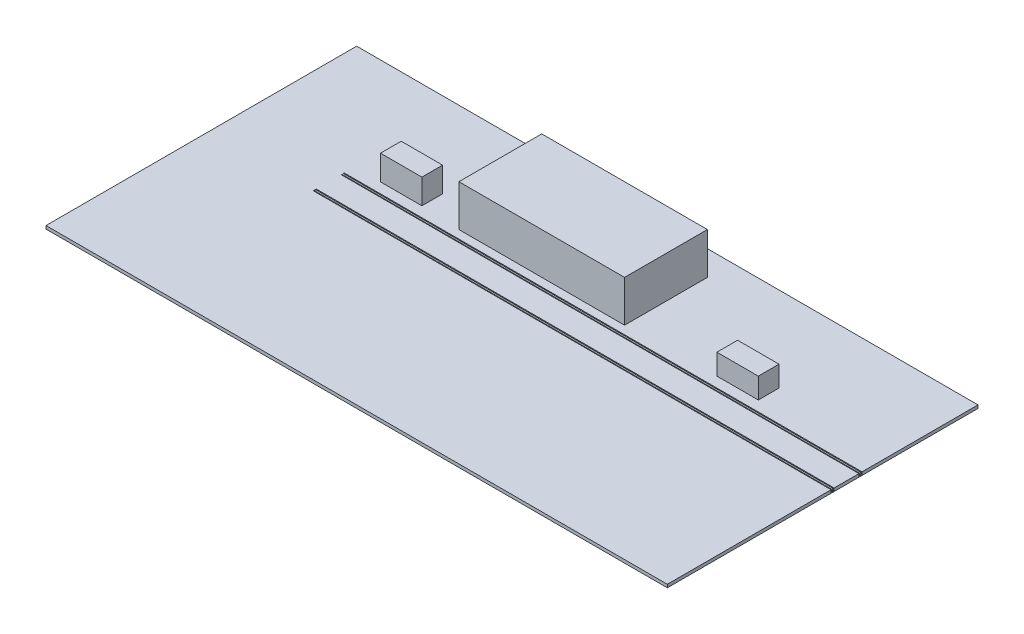
from build123d import *

# Parameters (mm, degrees)
SKETCH1_W           = 30000
SKETCH1_H           = 15000
BOSS_EXTRUDE3_DEPTH = 150
CUT_EXTRUDE1_DEPTH  = 150000
SKETCH4_W           = 2000
SKETCH4_H           = 1000
BOSS_EXTRUDE4_DEPTH = 1200
SKETCH7_W           = 2000
SKETCH7_H           = 1000
BOSS_EXTRUDE5_DEPTH = 1000
SKETCH8_W           = 8000
SKETCH8_H           = 4000
BOSS_EXTRUDE6_DEPTH = 2000


with BuildPart() as part:
    # Sketch1 → Boss-Extrude3 (new body)
    with BuildSketch(Plane(origin=(0, 0, 0), x_dir=(1, 0, 0), z_dir=(0, 1, 0))):
        with Locations((15000, 7500)):
            Rectangle(SKETCH1_W, SKETCH1_H)
    extrude(amount=BOSS_EXTRUDE3_DEPTH)

    # Sketch3 → Cut-Extrude1 (cut)
    with BuildSketch(Plane.ZY.offset(-5000)):
        with BuildLine():
            Line((-9252, 150), (-9400, 150))
            Line((-9400, 150), (-9400, 0))
            Line((-9400, 0), (-9392.770799758, 0))
            ThreePointArc((-9392.770799758, 0), (-9390.957813925, 6.200601455), (-9385.73215101, 9.998867262))
            Line((-9385.73215101, 9.998867262), (-9344.900263202, 22.612194817))
            ThreePointArc((-9344.900263202, 22.612194817), (-9339.804540817, 26.230161795), (-9337.851737232, 32.166712128))
            Line((-9337.851737232, 32.166712128), (-9337.851737232, 85.486065284))
            ThreePointArc((-9337.851737232, 85.486065284), (-9340.025655664, 91.71121165), (-9345.602226689, 95.229765932))
            Line((-9345.602226689, 95.229765932), (-9374.927332218, 102))
            Line((-9374.927332218, 102), (-9366.789341481, 137.249510543))
            ThreePointArc((-9366.789341481, 137.249510543), (-9363.2707872, 142.826081569), (-9357.045640833, 145))
            Line((-9357.045640833, 145), (-9294.954359167, 145))
            ThreePointArc((-9294.954359167, 145), (-9288.7292128, 142.826081569), (-9285.210658519, 137.249510543))
            Line((-9285.210658519, 137.249510543), (-9277.072667782, 102))
            Line((-9277.072667782, 102), (-9306.397773311, 95.229765932))
            ThreePointArc((-9306.397773311, 95.229765932), (-9311.974344336, 91.71121165), (-9314.148262768, 85.486065284))
            Line((-9314.148262768, 85.486065284), (-9314.148262768, 32.101727948))
            ThreePointArc((-9314.148262768, 32.101727948), (-9312.220447279, 26.199199912), (-9307.180295324, 22.57246887))
            Line((-9307.180295324, 22.57246887), (-9266.187290464, 9.529259078))
            ThreePointArc((-9266.187290464, 9.529259078), (-9261.147138509, 5.902528036), (-9259.21932302, 0))
            Line((-9259.21932302, 0), (-9252, 0))
            Line((-9252, 0), (-9252, 150))
        make_face()
    cut_extrude1 = extrude(amount=-CUT_EXTRUDE1_DEPTH, mode=Mode.SUBTRACT)

    # Mirror1: Cut-Extrude1 across plane
    add(cut_extrude1.mirror(Plane.XY.offset(-8652)), mode=Mode.SUBTRACT)

    # Sketch4 → Boss-Extrude4 (add)
    with BuildSketch(Plane(origin=(0, 150, 0), x_dir=(1, 0, 0), z_dir=(0, 1, 0))):
        with Locations((7249.238259699, 10400)):
            Rectangle(SKETCH4_W, SKETCH4_H)
    extrude(amount=BOSS_EXTRUDE4_DEPTH)

    # Sketch7 → Boss-Extrude5 (add)
    with BuildSketch(Plane(origin=(0, 150, 0), x_dir=(1, 0, 0), z_dir=(0, 1, 0))):
        with Locations((23492.439527583, 10400)):
            Rectangle(SKETCH7_W, SKETCH7_H)
    extrude(amount=BOSS_EXTRUDE5_DEPTH)

    # Sketch8 → Boss-Extrude6 (add)
    with BuildSketch(Plane(origin=(0, 150, 0), x_dir=(1, 0, 0), z_dir=(0, 1, 0))):
        with Locations((14135.668801115, 11800)):
            Rectangle(SKETCH8_W, SKETCH8_H)
    extrude(amount=BOSS_EXTRUDE6_DEPTH)


solid = part.part
